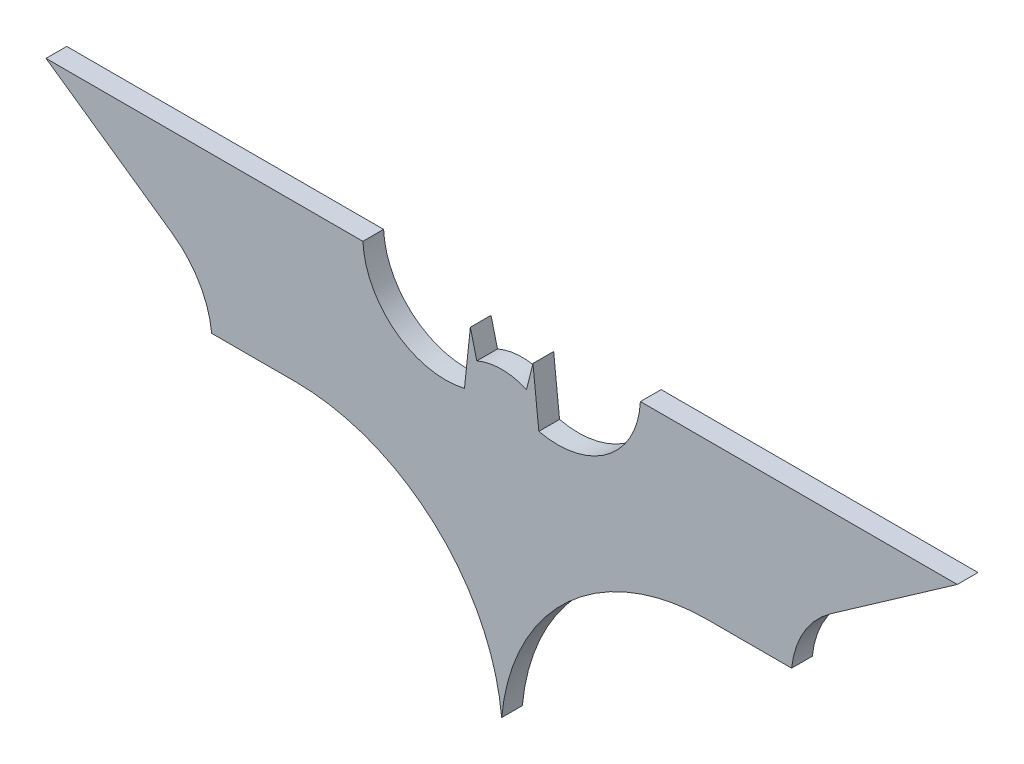
from build123d import *

# Parameters (mm, degrees)
BOSS_EXTRUDE1_DEPTH = 10


with BuildPart() as part:
    # Sketch1 → Boss-Extrude1 (new body)
    with BuildSketch(Plane.XY):
        with BuildLine():
            Line((67, 50), (220, 50))
            Line((220, 50), (158.952536164, 7.254105633))
            ThreePointArc((158.952536164, 7.254105633), (145.965681261, -6.810123789), (140, -25))
            Line((140, -25), (99.563224144, -25))
            ThreePointArc((99.563224144, -25), (32.234251016, -51.062124878), (0, -115.663812449))
            ThreePointArc((0, -115.663812449), (-32.234251016, -51.062124878), (-99.563224144, -25))
            Line((-99.563224144, -25), (-140, -25))
            ThreePointArc((-140, -25), (-145.965681261, -6.810123789), (-158.952536164, 7.254105633))
            Line((-158.952536164, 7.254105633), (-220, 50))
            Line((-220, 50), (-67, 50))
            ThreePointArc((-67, 50), (-51.137889855, 20.020793424), (-17.95554779, 13))
            Line((-17.95554779, 13), (-15.117733438, 40))
            Line((-15.117733438, 40), (-12, 27.49545417))
            ThreePointArc((-12, 27.49545417), (0, 30), (12, 27.49545417))
            Line((12, 27.49545417), (15.117733438, 40))
            Line((15.117733438, 40), (17.95554779, 13))
            ThreePointArc((17.95554779, 13), (51.137889855, 20.020793424), (67, 50))
        make_face()
    extrude(amount=BOSS_EXTRUDE1_DEPTH)


solid = part.part
